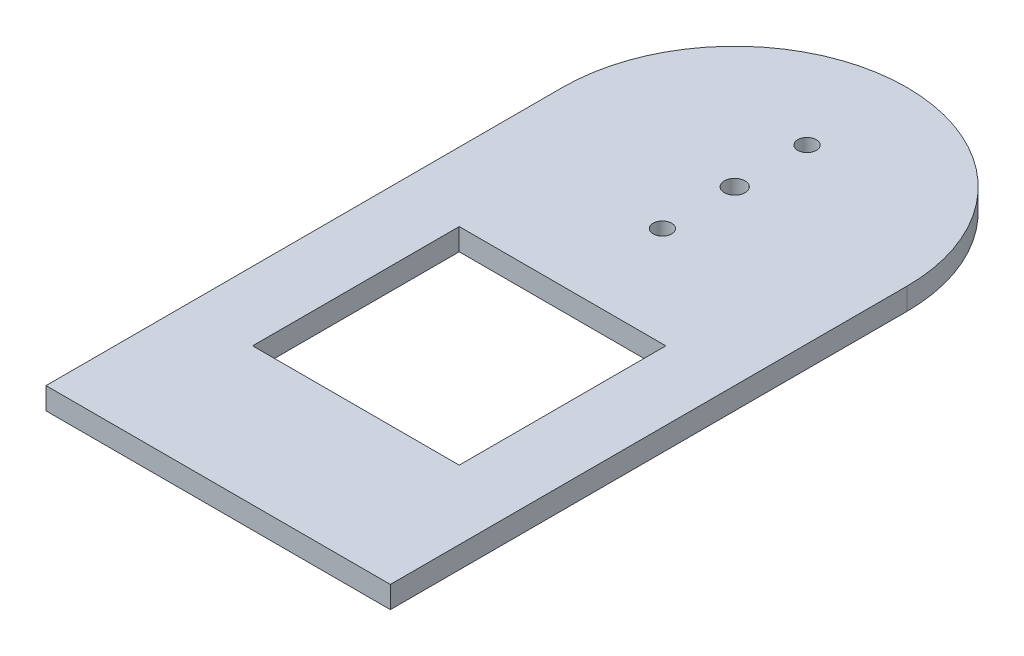
from build123d import *

# Parameters (mm, degrees)
SKETCH1_W           = 50
SKETCH1_H           = 100
SKETCH1_R           = 1.5
SKETCH1_R_2         = 1.35
SKETCH1_W_2         = 30
SKETCH1_H_2         = 30
BOSS_EXTRUDE1_DEPTH = 3.175
CUT_EXTRUDE1_DEPTH  = 6.35


with BuildPart() as part:
    # Sketch1 → Boss-Extrude1 (new body)
    with BuildSketch(Plane(origin=(0, 0, 0), x_dir=(1, 0, 0), z_dir=(0, 1, 0))):
        with Locations((25, -50)):
            Rectangle(SKETCH1_W, SKETCH1_H)
        with Locations(Location((25, -25, 0), (0, 0, 270))):
            Circle(SKETCH1_R, mode=Mode.SUBTRACT)
        with Locations(Location((25, -14.5, 0), (0, 0, 90))):
            Circle(SKETCH1_R_2, mode=Mode.SUBTRACT)
        with Locations(Location((25, -35.5, 0), (0, 0, 270))):
            Circle(SKETCH1_R_2, mode=Mode.SUBTRACT)
        with Locations((25, -65)):
            Rectangle(SKETCH1_W_2, SKETCH1_H_2, mode=Mode.SUBTRACT)
    extrude(amount=BOSS_EXTRUDE1_DEPTH)

    # Sketch2 → Cut-Extrude1 (cut)
    with BuildSketch(Plane(origin=(0, 3.175, 0), x_dir=(1, 0, 0), z_dir=(0, 1, 0))):
        with BuildLine():
            Line((0, 0), (0, -25))
            ThreePointArc((0, -25), (7.32233047, -7.32233047), (25, 0))
            Line((25, 0), (0, 0))
        make_face()
        with BuildLine():
            ThreePointArc((25, 0), (42.67766953, -7.32233047), (50, -25))
            Line((50, -25), (50, 0))
            Line((50, 0), (25, 0))
        make_face()
    extrude(amount=-CUT_EXTRUDE1_DEPTH, mode=Mode.SUBTRACT)


solid = part.part
